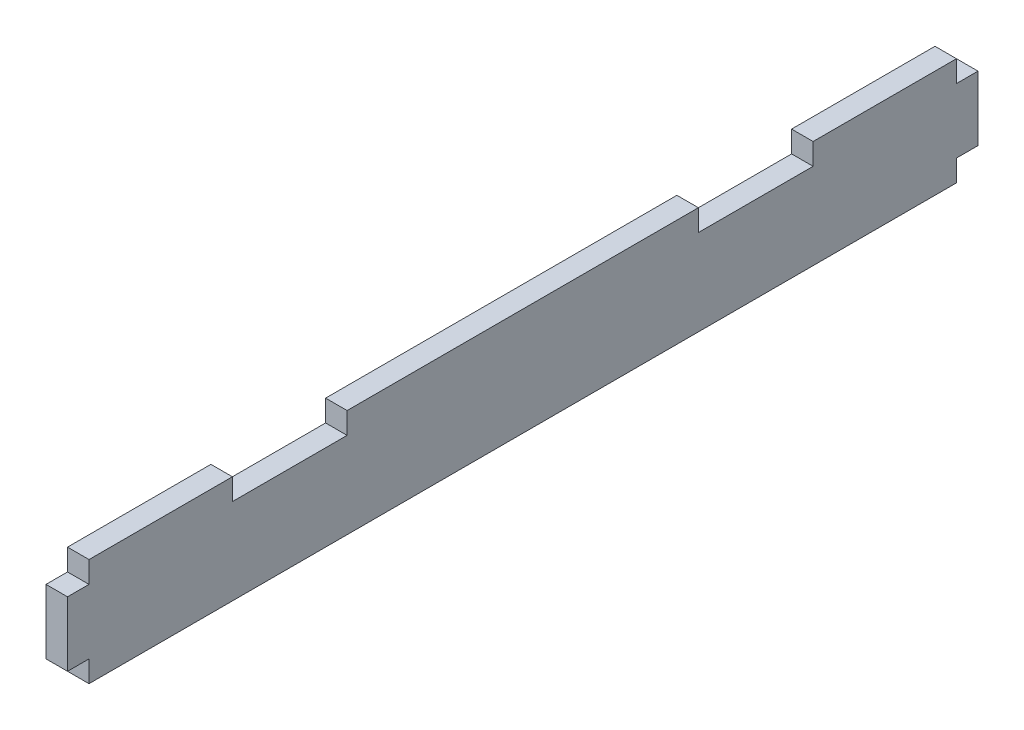
from build123d import *

# Parameters (mm, degrees)
SKETCH1_W           = 3
SKETCH1_H           = 9
BOSS_EXTRUDE1_DEPTH = 3


with BuildPart() as part:
    # Sketch1 → Boss-Extrude1 (new body)
    with BuildSketch(Plane(origin=(0, 0, 0), x_dir=(0, 0, -1), z_dir=(1, 0, 0))):
        Polygon((0, 3), (0, 0), (121, 0), (121, 3), (121, 12), (121, 15), (101, 15), (101, 12), (85, 12), (85, 15), (36, 15), (36, 12), (20, 12), (20, 15), (0, 15), (0, 12), align=None)
        with Locations((-1.5, 7.5)):
            Rectangle(SKETCH1_W, SKETCH1_H)
        with Locations((122.5, 7.5)):
            Rectangle(SKETCH1_W, SKETCH1_H)
    extrude(amount=BOSS_EXTRUDE1_DEPTH)


solid = part.part
